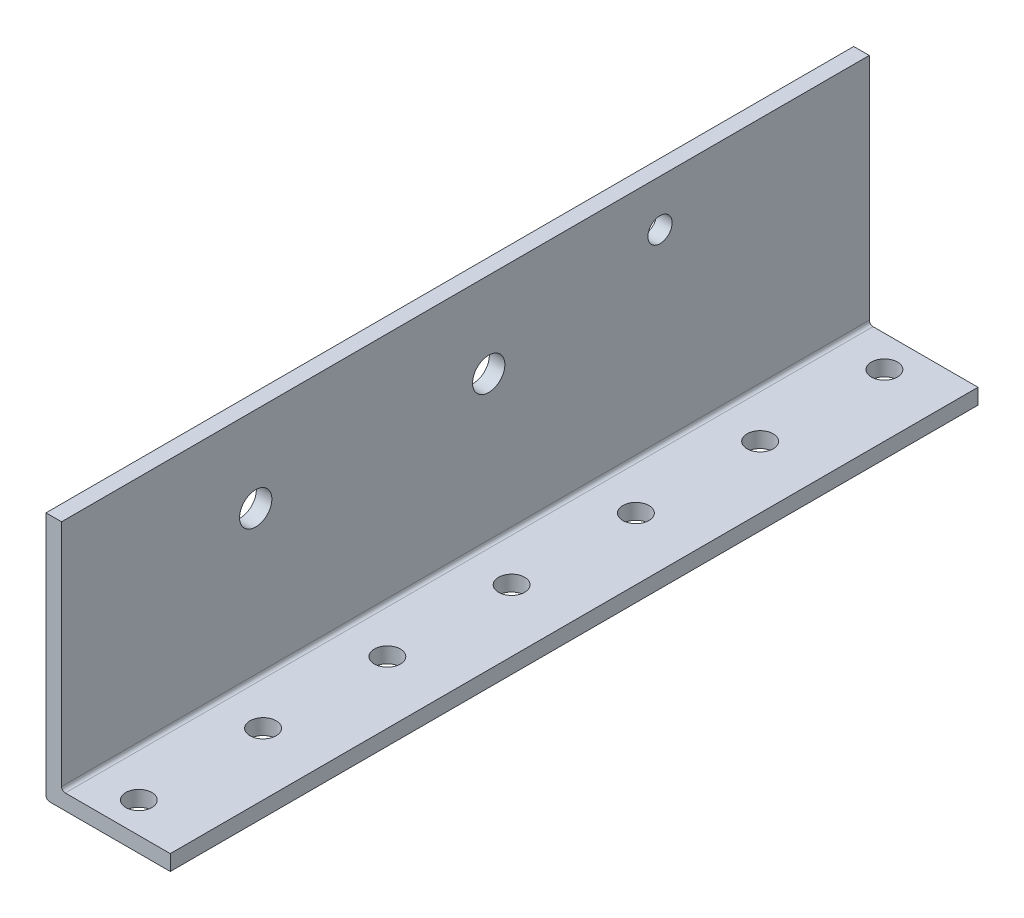
from build123d import *

# Parameters (mm, degrees)
BOSS_EXTRUDE1_DEPTH = 165.1
SKETCH3_R           = 2.667
CUT_EXTRUDE2_DEPTH  = 3.175
SKETCH4_R           = 3.302
CUT_EXTRUDE3_DEPTH  = 3.175
SKETCH5_R           = 2.4765
CUT_EXTRUDE4_DEPTH  = 6.35


with BuildPart() as part:
    # Sketch1 → Boss-Extrude1 (new body)
    with BuildSketch(Plane.XY):
        with BuildLine():
            Line((3.175, 50.8), (3.175, 3.937))
            ThreePointArc((3.175, 3.937), (3.398184633, 3.398184633), (3.937, 3.175))
            Line((3.937, 3.175), (25.4, 3.175))
            Line((25.4, 3.175), (25.4, 0))
            Line((25.4, 0), (0.762, 0))
            ThreePointArc((0.762, 0), (0.223184633, 0.223184633), (0, 0.762))
            Line((0, 0.762), (0, 50.8))
            Line((0, 50.8), (3.175, 50.8))
        make_face()
    extrude(amount=BOSS_EXTRUDE1_DEPTH)

    # Sketch3 → Cut-Extrude2 (cut)
    with BuildSketch(Plane.XZ):
        with Locations(Location((12.7, 6.42874, 0), (0, 0, 270))):
            Circle(SKETCH3_R)
        with Locations(Location((12.7, 31.82874, 0), (0, 0, 270))):
            Circle(SKETCH3_R)
        with Locations(Location((12.7, 57.22874, 0), (0, 0, 270))):
            Circle(SKETCH3_R)
        with Locations(Location((12.7, 82.62874, 0), (0, 0, 270))):
            Circle(SKETCH3_R)
        with Locations(Location((12.7, 108.02874, 0), (0, 0, 270))):
            Circle(SKETCH3_R)
        with Locations(Location((12.7, 133.42874, 0), (0, 0, 270))):
            Circle(SKETCH3_R)
        with Locations(Location((12.7, 158.82874, 0), (0, 0, 270))):
            Circle(SKETCH3_R)
    extrude(amount=-CUT_EXTRUDE2_DEPTH, mode=Mode.SUBTRACT)

    # Sketch4 → Cut-Extrude3 (cut)
    with BuildSketch(Plane(origin=(3.175, 0, 0), x_dir=(0, 0, -1), z_dir=(1, 0, 0))):
        with Locations(Location((-77.7875, 33.3375, 0), (0, 0, 90))):
            Circle(SKETCH4_R)
        with Locations(Location((-125.4125, 33.3375, 0), (0, 0, 90))):
            Circle(SKETCH4_R)
    extrude(amount=-CUT_EXTRUDE3_DEPTH, mode=Mode.SUBTRACT)

    # Sketch5 → Cut-Extrude4 (cut)
    with BuildSketch(Plane(origin=(6.35, 0, 0), x_dir=(0, 0, -1), z_dir=(1, 0, 0))):
        with Locations(Location((-42.773092, 41.347136, 0), (0, 0, 90))):
            Circle(SKETCH5_R)
    extrude(amount=-CUT_EXTRUDE4_DEPTH, mode=Mode.SUBTRACT)


solid = part.part
